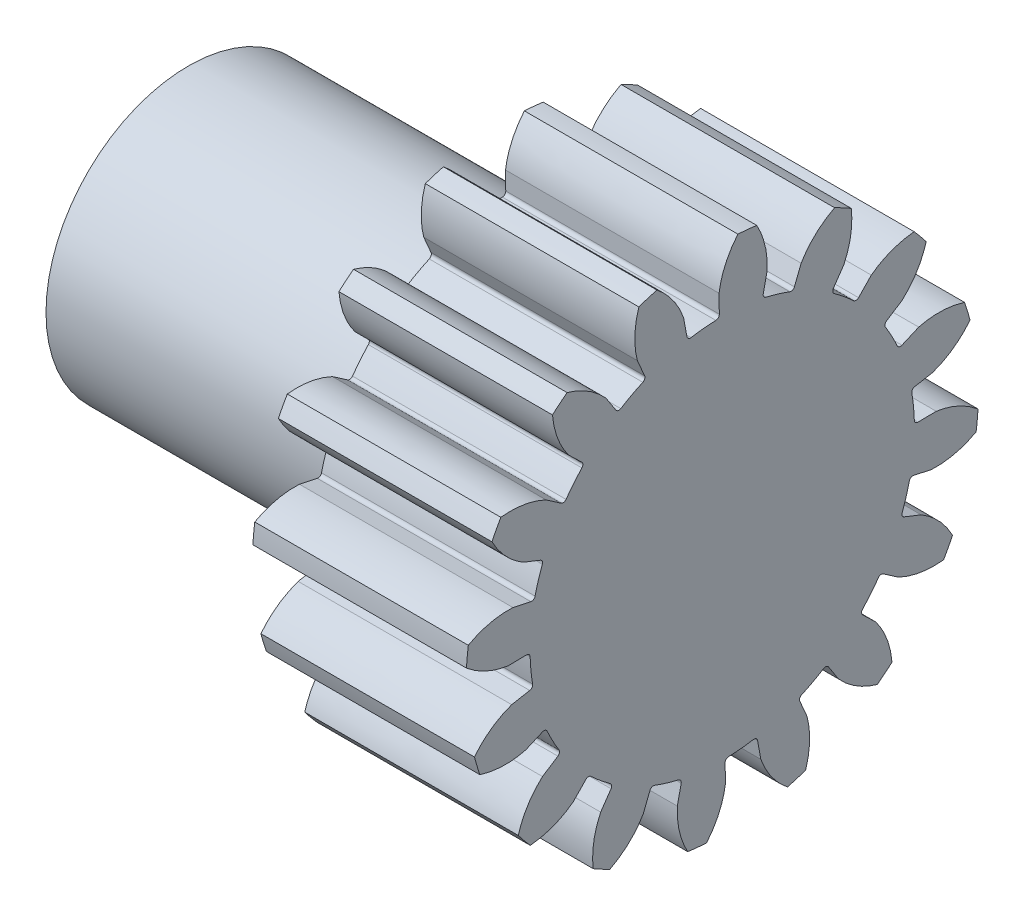
from build123d import *

# Parameters (mm, degrees)
SKETCH_2_R                       = 5.4
EXTRUDE_2_DEPTH                  = 6
SKETCH_5_R                       = 4
EXTRUDE_4_DEPTH                  = 9
HOLE_WIZARD_M31_D                = 2.5
HOLE_WIZARD_M31_DEPTH            = 8.5
HOLE_WIZARD_M31_CSINK_D          = 5
HOLE_WIZARD_M31_CSINK_ANGLE      = 90
HOLE_WIZARD_M31_TIP              = 0.751075774
EXTRUDE_5_REACH                  = 16.224
EXTRUDE_5_DIRECTION_2_REACH      = 16.224
FILLET_4_R                       = 0.1
PATTERN_CIRCULAR_1_COUNT         = 16
FILLET_4_OF_PATTERN_CIRCULAR_1_R = 0.1
FILLET_5_R                       = 0.2


with BuildPart() as part:
    # Эскиз2 → Бобышка-Вытянуть2 (new body)
    with BuildSketch(Plane(origin=(0, 0, 0), x_dir=(0, 0, -1), z_dir=(1, 0, 0))):
        Circle(SKETCH_2_R)
    extrude(amount=EXTRUDE_2_DEPTH)

    # Эскиз5 → Бобышка-Вытянуть4 (add)
    with BuildSketch(Plane.ZY):
        Circle(SKETCH_5_R)
    extrude(amount=EXTRUDE_4_DEPTH)

    # Отверстие обработанное метчиком M31
    with Locations(Plane.ZY.offset(9)):
        with Locations((0, 0)):
            CounterSinkHole(HOLE_WIZARD_M31_D / 2, HOLE_WIZARD_M31_CSINK_D / 2, depth=HOLE_WIZARD_M31_DEPTH, counter_sink_angle=HOLE_WIZARD_M31_CSINK_ANGLE)
            with Locations((0, 0, -(HOLE_WIZARD_M31_DEPTH + HOLE_WIZARD_M31_TIP / 2))):  # 118° drill point
                Cone(0, HOLE_WIZARD_M31_D / 2, HOLE_WIZARD_M31_TIP, mode=Mode.SUBTRACT)

    # Бобышка-Вытянуть5: up to this face of the body (flat: up to its plane)
    extrude_5_end = Plane(part.part.faces().sort_by_distance((6, 0, 0))[0])
    # Эскиз9 → Бобышка-Вытянуть5 (add, up to the picked face)
    with BuildSketch(Plane(origin=(3, 0, 0), x_dir=(0, 0, -1), z_dir=(1, 0, 0)), mode=Mode.PRIVATE) as extrude_5_sk1:
        with BuildLine():
            Line((-0.089632134, 6.013364805), (-0.080480693, 5.399400231))
            ThreePointArc((-0.080480693, 5.399400231), (0.529292558, 5.373997524), (1.132305009, 5.279951266))
            Line((1.132305009, 5.279951266), (1.261059154, 5.880333324))
            add(Edge.make_bspline(
                [(1.261059154, 5.880333324), (1.295696363, 6.538751311), (0.970178552, 7.134336239)],
                knots=[0, 0, 0, 1, 1, 1], degree=2))
            ThreePointArc((0.970178552, 7.134336239), (0.70572341, 7.165330032), (0.440303111, 7.186524415))
            add(Edge.make_bspline(
                [(-0.089632134, 6.013364805), (0.004847178, 6.665888859), (0.440303111, 7.186524415)],
                knots=[0, 0, 0, 1, 1, 1], degree=2))
        make_face()
    extrude_5_tool1 = split(extrude(extrude_5_sk1.sketch, amount=EXTRUDE_5_REACH, mode=Mode.PRIVATE), bisect_by=extrude_5_end, keep=Keep.BOTH, mode=Mode.PRIVATE)
    extrude_5 = extrude_5_tool1.solids().sort_by(Axis((3, 6.178183, -0.608498), (1, 0, 0)))[0]
    add(extrude_5)

    # Бобышка-Вытянуть5 direction 2: up to this face of the body (flat: up to its plane)
    extrude_5_direction_2_end = Plane(part.part.faces().sort_by_distance((0, 0, 5.247264935))[0])
    # Эскиз9 → Бобышка-Вытянуть5 direction 2 (add, up to the picked face)
    with BuildSketch(Plane(origin=(3, 0, 0), x_dir=(0, 0, -1), z_dir=(1, 0, 0)), mode=Mode.PRIVATE) as extrude_5_direction_2_sk1:
        with BuildLine():
            Line((-0.089632134, 6.013364805), (-0.080480693, 5.399400231))
            ThreePointArc((-0.080480693, 5.399400231), (0.529292558, 5.373997524), (1.132305009, 5.279951266))
            Line((1.132305009, 5.279951266), (1.261059154, 5.880333324))
            add(Edge.make_bspline(
                [(1.261059154, 5.880333324), (1.295696363, 6.538751311), (0.970178552, 7.134336239)],
                knots=[0, 0, 0, 1, 1, 1], degree=2))
            ThreePointArc((0.970178552, 7.134336239), (0.70572341, 7.165330032), (0.440303111, 7.186524415))
            add(Edge.make_bspline(
                [(-0.089632134, 6.013364805), (0.004847178, 6.665888859), (0.440303111, 7.186524415)],
                knots=[0, 0, 0, 1, 1, 1], degree=2))
        make_face()
    extrude_5_direction_2_tool1 = split(extrude(extrude_5_direction_2_sk1.sketch, amount=-EXTRUDE_5_DIRECTION_2_REACH, mode=Mode.PRIVATE), bisect_by=extrude_5_direction_2_end, keep=Keep.BOTH, mode=Mode.PRIVATE)
    extrude_5_direction_2 = extrude_5_direction_2_tool1.solids().sort_by(Axis((3, 6.178183, -0.608498), (-1, 0, 0)))[0]
    add(extrude_5_direction_2)

    # Скругление4
    fillet_4_edges = [part.edges().sort_by_distance(p)[0] for p in [
        (3, 5.399400231, 0.080480693),
        (3, 5.279951266, -1.132305009),
    ]]
    fillet(fillet_4_edges, radius=FILLET_4_R)

    # Круговой массив1: Бобышка-Вытянуть5, Бобышка-Вытянуть5 direction 2 ×16 about axis
    pattern_circular_1_axis = Axis((6, 0, 0), (-1, 0, 0))
    add([extrude_5.rotate(pattern_circular_1_axis, i * 360 / PATTERN_CIRCULAR_1_COUNT) for i in range(1, PATTERN_CIRCULAR_1_COUNT)])
    add([extrude_5_direction_2.rotate(pattern_circular_1_axis, i * 360 / PATTERN_CIRCULAR_1_COUNT) for i in range(1, PATTERN_CIRCULAR_1_COUNT)])

    # Скругление4 of Круговой массив1
    fillet_4_of_pattern_circular_1_edges = [part.edges().sort_by_distance(p)[0] for p in [
        (3, 5.019193989, -1.991906548),
        (3, 4.44472454, -3.066663295),
        (3, 3.874860962, -3.761044074),
        (3, 2.932828794, -4.534149894),
        (3, 2.140615478, -4.957596734),
        (3, 0.974436451, -5.311353274),
        (3, 0.080480693, -5.399400231),
        (3, -1.132305009, -5.279951266),
        (3, -1.991906548, -5.019193989),
        (3, -3.066663295, -4.44472454),
        (3, -3.761044074, -3.874860962),
        (3, -4.534149894, -2.932828794),
        (3, -4.957596734, -2.140615478),
        (3, -5.311353274, -0.974436451),
        (3, -5.399400231, -0.080480693),
        (3, -5.279951266, 1.132305009),
        (3, -5.019193989, 1.991906548),
        (3, -4.44472454, 3.066663295),
        (3, -3.874860962, 3.761044074),
        (3, -2.932828794, 4.534149894),
        (3, -2.140615478, 4.957596734),
        (3, -0.974436451, 5.311353274),
        (3, -0.080480693, 5.399400231),
        (3, 1.132305009, 5.279951266),
        (3, 1.991906548, 5.019193989),
        (3, 3.066663295, 4.44472454),
        (3, 3.761044074, 3.874860962),
        (3, 4.534149894, 2.932828794),
        (3, 4.957596734, 2.140615478),
        (3, 5.311353274, 0.974436451),
    ]]
    fillet(fillet_4_of_pattern_circular_1_edges, radius=FILLET_4_OF_PATTERN_CIRCULAR_1_R)

    # Эскиз11 → Вырез-Повернуть3 (revolve, cut)
    with BuildSketch(Plane.XY, mode=Mode.PRIVATE) as cut_revolve_3_sk:
        Polygon((0, 4), (0, 3.7), (-0.5, 3.7), (-0.8, 4), align=None)
    revolve(cut_revolve_3_sk.sketch.rotate(Axis((-9, 0, 0), (1, 0, 0)), 90), axis=Axis((-9, 0, 0), (1, 0, 0)), mode=Mode.SUBTRACT)

    # Скругление5
    fillet_5_edges = [part.edges().sort_by_distance(p)[0] for p in [
        (0, 0, -3.7),
        (-0.5, 0, -3.7),
    ]]
    fillet(fillet_5_edges, radius=FILLET_5_R)


solid = part.part
